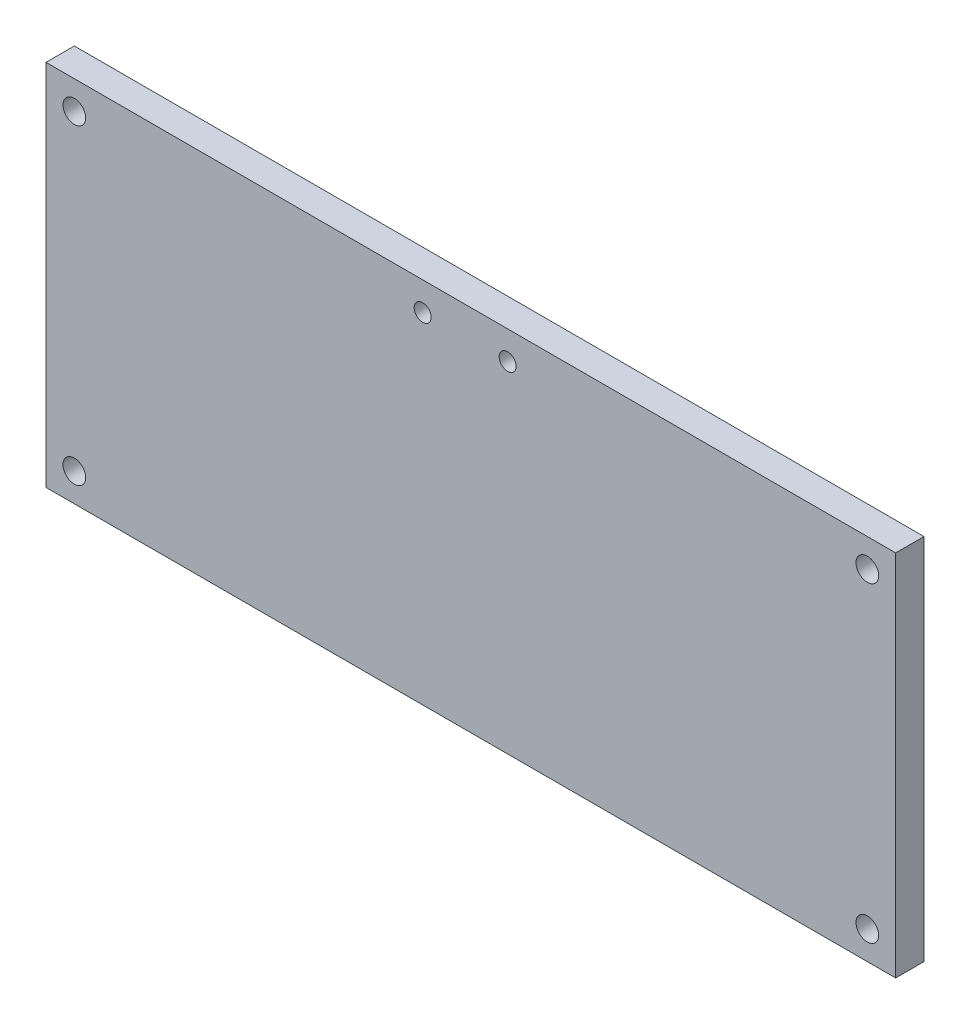
from build123d import *

# Parameters (mm, degrees)
ESQUISSE1_W             = 300
ESQUISSE1_H             = 130
BOSS_EXTRU_1_DEPTH      = 10
ESQUISSE2_R             = 4
ENL_V_MAT_EXTRU_1_DEPTH = 258.188939373
ESQUISSE3_R             = 3
ENL_V_MAT_EXTRU_2_DEPTH = 258.188939373


with BuildPart() as part:
    # Esquisse1 → Boss.-Extru.1 (new body)
    with BuildSketch(Plane.XY):
        with Locations((71.689310829, 65)):
            Rectangle(ESQUISSE1_W, ESQUISSE1_H)
    extrude(amount=BOSS_EXTRU_1_DEPTH)

    # Esquisse2 → Enlèv. mat.-Extru.1 (cut, through all)
    with BuildSketch(Plane.XY.offset(10)):
        with Locations((-68.310689171, 120)):
            Circle(ESQUISSE2_R)
        with Locations((-68.310689171, 10)):
            Circle(ESQUISSE2_R)
        with Locations((211.689310829, 10)):
            Circle(ESQUISSE2_R)
        with Locations((211.689310829, 120)):
            Circle(ESQUISSE2_R)
    extrude(amount=-ENL_V_MAT_EXTRU_1_DEPTH, mode=Mode.SUBTRACT)

    # Esquisse3 → Enlèv. mat.-Extru.2 (cut, through all)
    with BuildSketch(Plane.XY.offset(10)):
        with Locations((84.689310829, 120)):
            Circle(ESQUISSE3_R)
        with Locations((54.689310829, 120)):
            Circle(ESQUISSE3_R)
    extrude(amount=-ENL_V_MAT_EXTRU_2_DEPTH, mode=Mode.SUBTRACT)


solid = part.part
